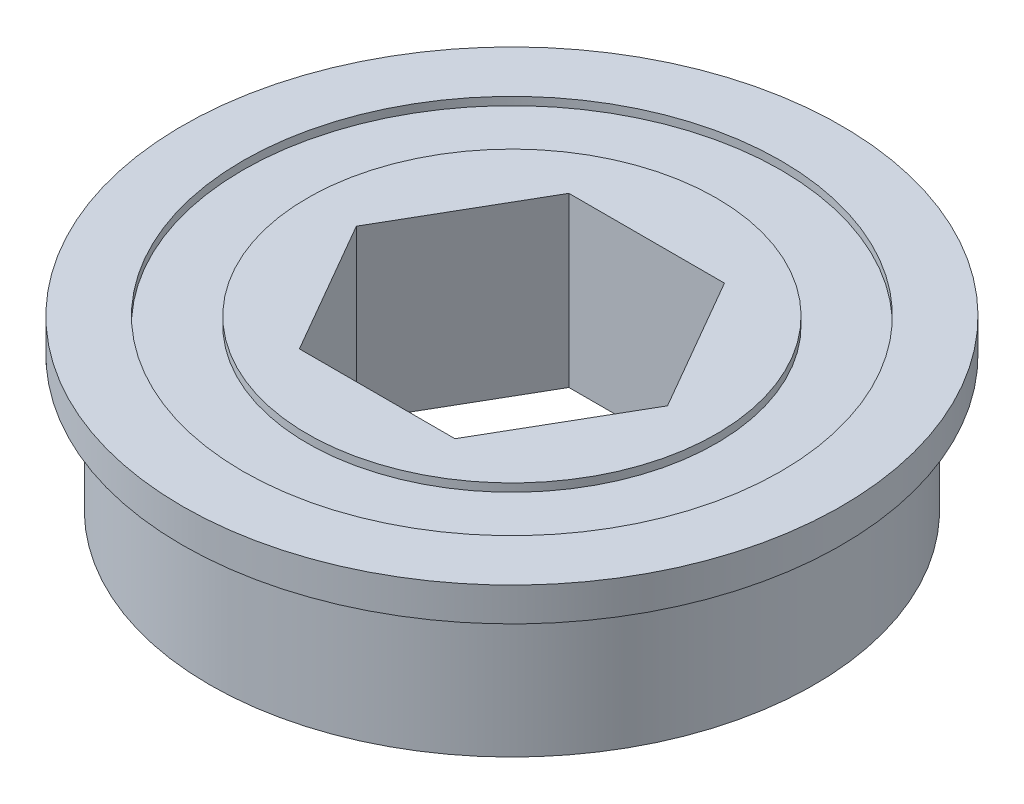
from build123d import *

# Parameters (mm, degrees)
SKETCH3_R          = 12.7
SKETCH3_R_2        = 9.652
CUT_EXTRUDE1_DEPTH = 0.381
CUT_EXTRUDE2_DEPTH = 24.389645546
CUT_EXTRUDE3_START = -0.381
SKETCH5_R          = 12.7
SKETCH5_R_2        = 9.652
CUT_EXTRUDE3_DEPTH = 0.381


with BuildPart() as part:
    # Sketch1 → Revolve1 (revolve)
    with BuildSketch(Plane.XY, mode=Mode.PRIVATE) as revolve1_sk:
        with BuildLine():
            Line((-14.2748, 0), (0, 0))
            Line((0, 0), (0, 7.9375))
            Line((0, 7.9375), (-15.5575, 7.9375))
            Line((-15.5575, 7.9375), (-15.5575, 6.35))
            Line((-15.5575, 6.35), (-14.2748, 6.35))
            ThreePointArc((-14.2748, 6.35), (-14.058293649, 6.225), (-14.058293649, 5.975))
            Line((-14.058293649, 5.975), (-14.2748, 5.6))
            Line((-14.2748, 5.6), (-14.2748, 0))
        make_face()
    revolve(revolve1_sk.sketch.rotate(Axis((0, 0, 0), (0, 1, 0)), 90), axis=Axis((0, 0, 0), (0, 1, 0)))

    # Sketch3 → Cut-Extrude1 (cut)
    with BuildSketch(Plane.XZ):
        with Locations(Location((0, 0, 0), (0, 0, 90))):
            Circle(SKETCH3_R)
        with Locations(Location((0, 0, 0), (0, 0, 90))):
            Circle(SKETCH3_R_2, mode=Mode.SUBTRACT)
    extrude(amount=-CUT_EXTRUDE1_DEPTH, mode=Mode.SUBTRACT)

    # Sketch4 → Cut-Extrude2 (cut, through all)
    with BuildSketch(Plane.XZ):
        Polygon((-7.343895401, 0), (-3.6719477, -6.35999998), (3.6719477, -6.35999998), (7.343895401, 0), (3.6719477, 6.35999998), (-3.6719477, 6.35999998), align=None)
    extrude(amount=-CUT_EXTRUDE2_DEPTH, mode=Mode.SUBTRACT)

    # Sketch5 → Cut-Extrude3 (cut)
    with BuildSketch(Plane(origin=(0, 7.9375, 0), x_dir=(-1, 0, 0), z_dir=(0, 1, 0)).offset(CUT_EXTRUDE3_START)):
        with Locations(Location((0, 0, 0), (0, 0, 90))):
            Circle(SKETCH5_R)
        with Locations(Location((0, 0, 0), (0, 0, 90))):
            Circle(SKETCH5_R_2, mode=Mode.SUBTRACT)
    extrude(amount=CUT_EXTRUDE3_DEPTH, mode=Mode.SUBTRACT)


solid = part.part
